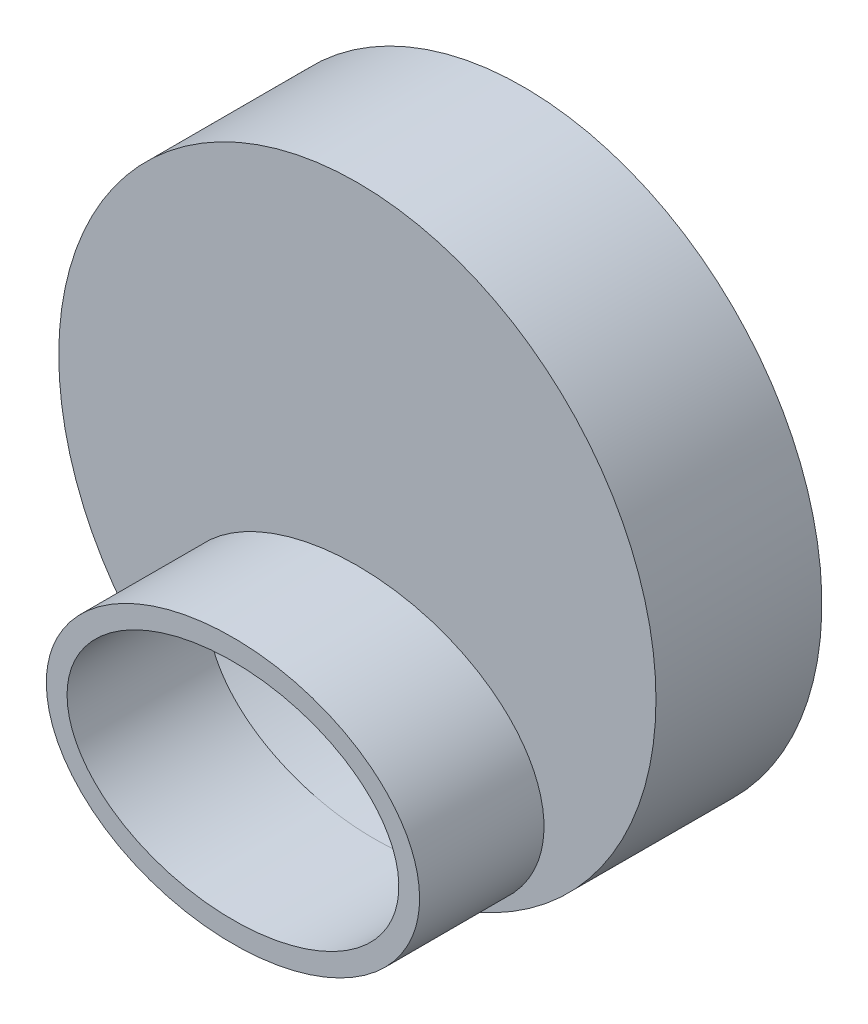
from build123d import *

# Parameters (mm, degrees)
CROQUIS1_R              = 36
CROQUIS1_RX             = 20
CROQUIS1_RY             = 13.5
SALIENTE_EXTRUIR1_DEPTH = 2
CROQUIS2_RX             = 22.5
CROQUIS2_RY             = 16
CROQUIS2_RX_2           = 20
CROQUIS2_RY_2           = 13.5
SALIENTE_EXTRUIR2_DEPTH = 15
SALIENTE_EXTRUIR3_START = 18
CROQUIS3_R              = 36
CROQUIS3_R_2            = 33.5
SALIENTE_EXTRUIR3_DEPTH = 18


with BuildPart() as part:
    # Croquis1 → Saliente-Extruir1 (new body)
    with BuildSketch(Plane.XY):
        with Locations((0, 20)):
            Circle(CROQUIS1_R)
        with Locations(Location((0, 0), (0, 0, 180))):
            Ellipse(CROQUIS1_RX, CROQUIS1_RY, mode=Mode.SUBTRACT)
    extrude(amount=SALIENTE_EXTRUIR1_DEPTH)

    # Croquis2 → Saliente-Extruir2 (add)
    with BuildSketch(Plane.XY.offset(2)):
        with Locations(Location((0, 0), (0, 0, -180))):
            Ellipse(CROQUIS2_RX, CROQUIS2_RY)
        with Locations(Location((0, 0), (0, 0, 180))):
            Ellipse(CROQUIS2_RX_2, CROQUIS2_RY_2, mode=Mode.SUBTRACT)
    extrude(amount=SALIENTE_EXTRUIR2_DEPTH)

    # Croquis3 → Saliente-Extruir3 (add)
    with BuildSketch(Plane(origin=(0, 0, 0), x_dir=(-1, 0, 0), z_dir=(0, 0, -1)).offset(SALIENTE_EXTRUIR3_START)):
        with Locations((0, 20)):
            Circle(CROQUIS3_R)
        with Locations(Location((0, 20, 0), (0, 0, 270))):
            Circle(CROQUIS3_R_2, mode=Mode.SUBTRACT)
    extrude(amount=-SALIENTE_EXTRUIR3_DEPTH)


solid = part.part
